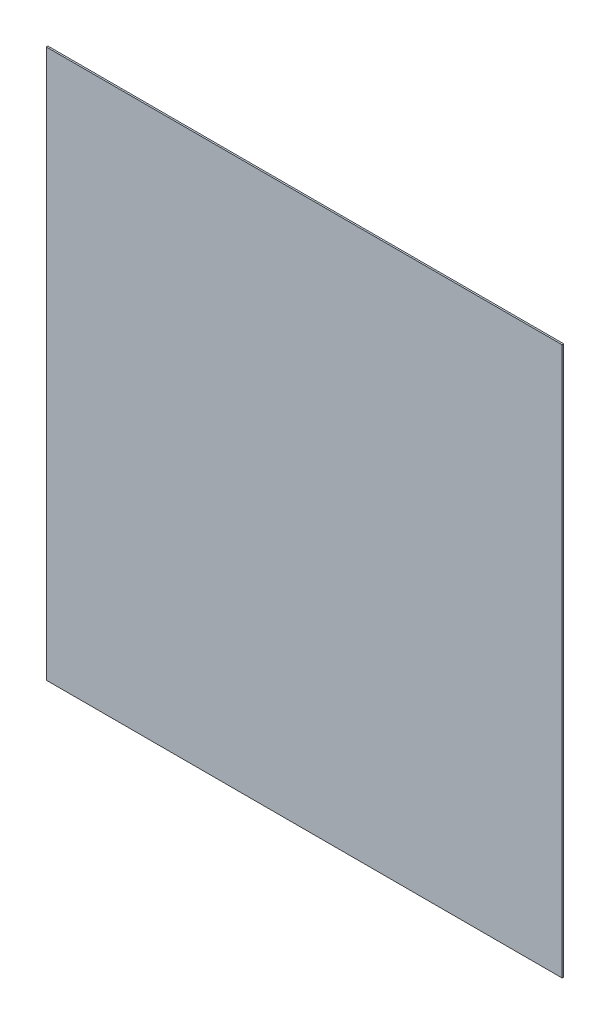
from build123d import *

# Parameters (mm, degrees)
SZKIC1_W                    = 1580
SZKIC1_H                    = 1680
DODANIE_WYCI_GNI_CIE1_DEPTH = 5


with BuildPart() as part:
    # Szkic1 → Dodanie-wyciągnięcie1 (new body)
    with BuildSketch(Plane.XY):
        with Locations((790, 840)):
            Rectangle(SZKIC1_W, SZKIC1_H)
    extrude(amount=DODANIE_WYCI_GNI_CIE1_DEPTH)


solid = part.part
